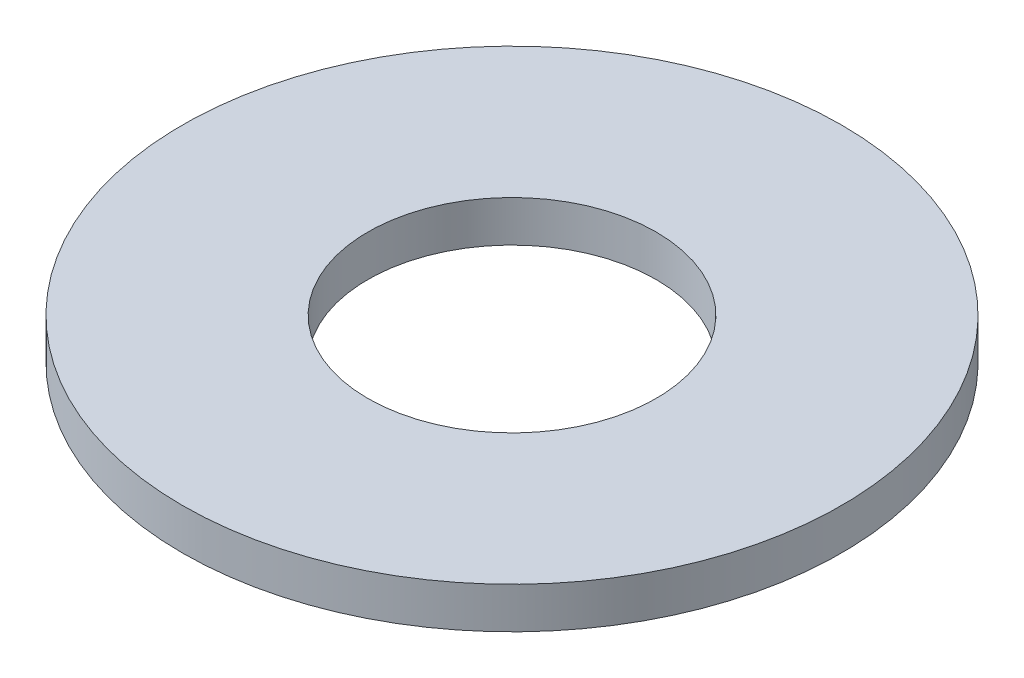
from build123d import *

# Parameters (mm, degrees)
SKETCH1_R           = 8
SKETCH1_R_2         = 3.5
BOSS_EXTRUDE1_DEPTH = 1


with BuildPart() as part:
    # Sketch1 → Boss-Extrude1 (new body)
    with BuildSketch(Plane(origin=(0, 0, 0), x_dir=(1, 0, 0), z_dir=(0, 1, 0))):
        with Locations(Location((0, 0, 0), (0, 0, 270))):
            Circle(SKETCH1_R)
        with Locations(Location((0, 0, 0), (0, 0, 270))):
            Circle(SKETCH1_R_2, mode=Mode.SUBTRACT)
    extrude(amount=BOSS_EXTRUDE1_DEPTH)


solid = part.part
